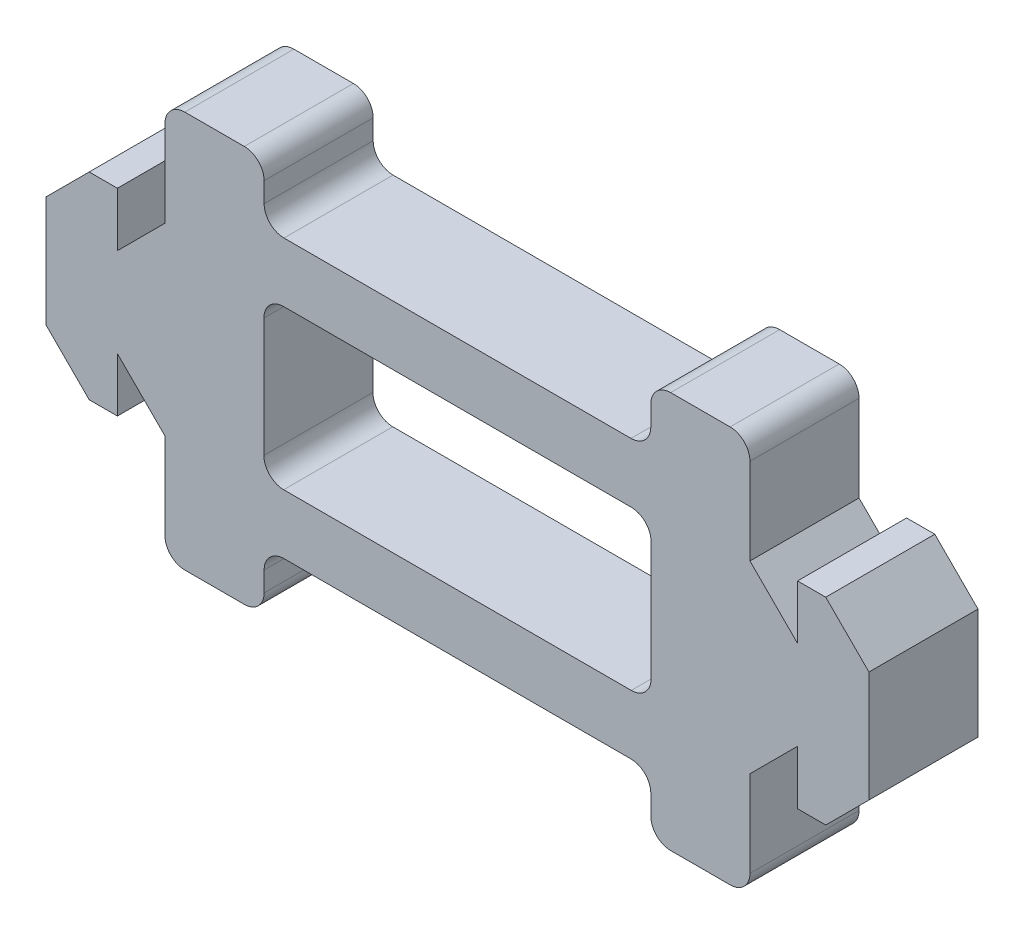
from build123d import *

# Parameters (mm, degrees)
BOSS_EXTRUDE1_DEPTH = 5.5
SKETCH3_W           = 19.5
SKETCH3_H           = 3
SKETCH3_W_2         = 19.527752912
SKETCH3_H_2         = 8
CUT_EXTRUDE1_DEPTH  = 48.152014803
FILLET1_R           = 1


with BuildPart() as part:
    # Sketch1 → Boss-Extrude1 (new body)
    with BuildSketch(Plane.XY):
        Polygon((39.75, 10), (10.25, 10), (10.25, 8.5), (10.25, 4.646446609), (7.85, 2.246446609), (7.85, 4.975), (6.428553391, 4.975), (4.25, 2.796446609), (4.25, -2.796446609), (6.428553391, -4.975), (7.85, -4.975), (7.85, -2.246446609), (10.25, -4.646446609), (10.25, -8.5), (10.25, -10), (39.75, -10), (39.75, -8.5), (39.75, -4.646446609), (42.15, -2.246446609), (42.15, -4.975), (43.571446609, -4.975), (45.75, -2.796446609), (45.75, 2.796446609), (43.571446609, 4.975), (42.15, 4.975), (42.15, 2.246446609), (39.75, 4.646446609), (39.75, 8.5), align=None)
    extrude(amount=BOSS_EXTRUDE1_DEPTH)

    # Sketch3 → Cut-Extrude1 (cut, through all)
    with BuildSketch(Plane.XY.offset(5.5)):
        with Locations((25, 8.5)):
            Rectangle(SKETCH3_W, SKETCH3_H)
        with Locations((25, -8.5)):
            Rectangle(SKETCH3_W, SKETCH3_H)
        with Locations((25, 0)):
            Rectangle(SKETCH3_W_2, SKETCH3_H_2)
    extrude(amount=-CUT_EXTRUDE1_DEPTH, mode=Mode.SUBTRACT)

    # Fillet1
    fillet1_edges = [part.edges().sort_by_distance(p)[0] for p in [
        (15.25, -10, 2.75),
        (15.25, -7, 2.75),
        (34.75, -7, 2.75),
        (34.75, -10, 2.75),
        (15.236123544, -4, 2.75),
        (15.236123544, 4, 2.75),
        (34.763876456, 4, 2.75),
        (34.763876456, -4, 2.75),
        (10.25, 10, 2.75),
        (39.75, 10, 2.75),
        (39.75, -10, 2.75),
        (10.25, -10, 2.75),
        (15.25, 7, 2.75),
        (15.25, 10, 2.75),
        (34.75, 10, 2.75),
        (34.75, 7, 2.75),
    ]]
    fillet(fillet1_edges, radius=FILLET1_R)


solid = part.part
